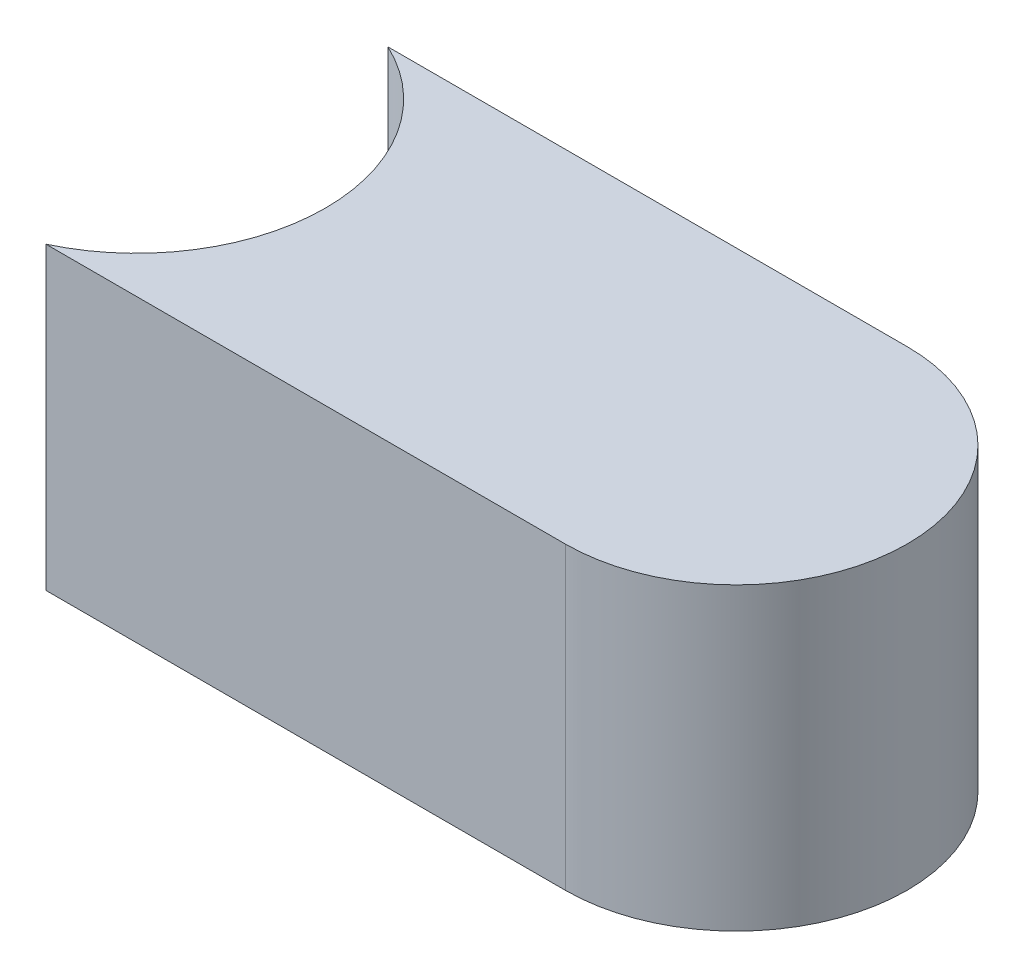
from build123d import *

# Parameters (mm, degrees)
BOSS_EXTRUDE1_DEPTH = 5


with BuildPart() as part:
    # Sketch1 → Boss-Extrude1 (new body)
    with BuildSketch(Plane(origin=(0, 0, 0), x_dir=(1, 0, 0), z_dir=(0, 1, 0))):
        with BuildLine():
            Line((4.367778344, 2.85), (13.02613822, 2.85))
            ThreePointArc((13.02613822, 2.85), (15.876136903, 0.002892262), (13.031922741, -2.84999428))
            Line((13.031922741, -2.84999428), (4.367778344, -2.849994134))
            ThreePointArc((4.367778344, -2.849994134), (6.17613528, 2.933e-06), (4.367778344, 2.85))
        make_face()
    extrude(amount=BOSS_EXTRUDE1_DEPTH)


solid = part.part
